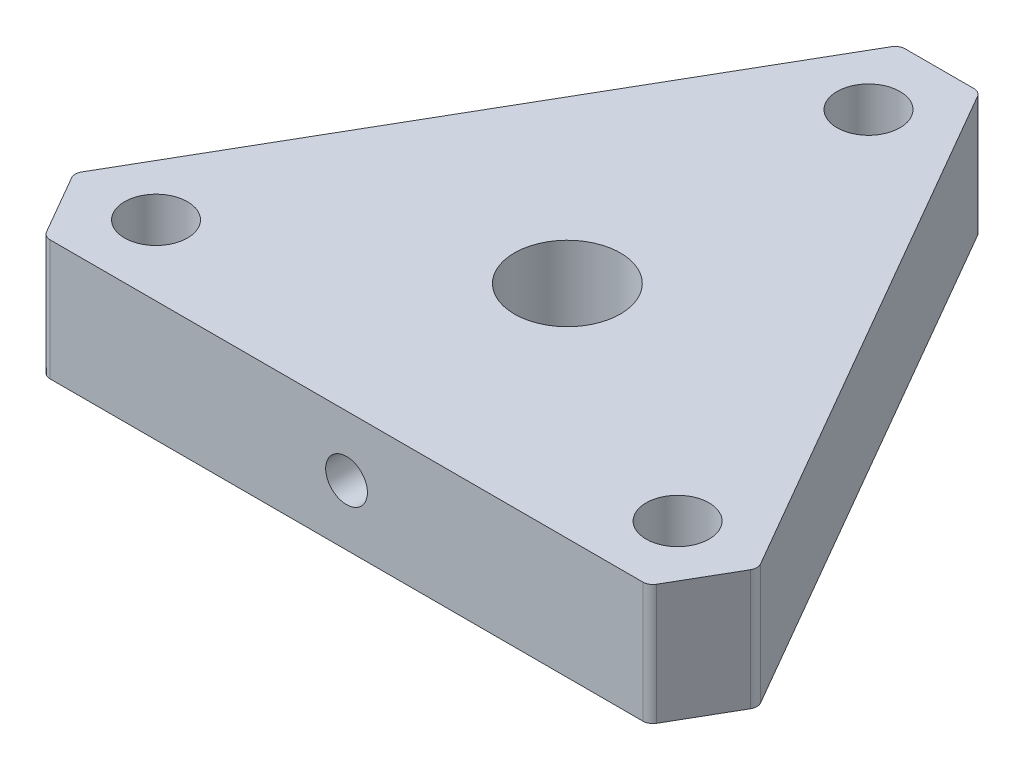
from build123d import *

# Parameters (mm, degrees)
SKETCH1_R                        = 4.191
BOSS_EXTRUDE1_DEPTH              = 9.525
F_10_CLEARANCE_HOLE1_D           = 4.9784
TAP_DRILL_FOR_M4X0_7_TAP1_REACH  = 62.679
TAP_DRILL_FOR_M4X0_7_TAP1_BORE_R = 1.65
CHAMFER1_SIZE                    = 6.35
CHAMFER1_EDGE_2_SIZE             = 6.35
CHAMFER1_EDGE_3_SIZE             = 6.35
FILLET2_R                        = 0.79375


with BuildPart() as part:
    # Sketch1 → Boss-Extrude1 (new body)
    with BuildSketch(Plane(origin=(0, 0, 0), x_dir=(1, 0, 0), z_dir=(0, 1, 0))):
        Polygon((0, 34.925), (30.245937227, -17.4625), (-30.245937227, -17.4625), align=None)
        with Locations(Location((0, 0, 0), (0, 0, 270))):
            Circle(SKETCH1_R, mode=Mode.SUBTRACT)
    extrude(amount=-BOSS_EXTRUDE1_DEPTH)

    # #10 Clearance Hole1 (through all)
    with Locations(Plane(origin=(0, 0, -23.8125), x_dir=(0, 0, 1), z_dir=(0, 1, 0))):
        with Locations((0, 0), (35.71875, 20.622229928), (35.71875, -20.622229928)):
            Hole(F_10_CLEARANCE_HOLE1_D / 2)

    # Tap Drill for M4x0.7 Tap1 bore (on position points) → Tap Drill for M4x0.7 Tap1 (cut, up to next)
    with BuildSketch(Plane(origin=(0, -4.7625, 17.4625), x_dir=(1, 0, 0), z_dir=(0, 0, 1)), mode=Mode.PRIVATE) as tap_drill_for_m4x0_7_tap1_sk1:
        Circle(TAP_DRILL_FOR_M4X0_7_TAP1_BORE_R)
    tap_drill_for_m4x0_7_tap1_tool1 = extrude(tap_drill_for_m4x0_7_tap1_sk1.sketch, amount=-TAP_DRILL_FOR_M4X0_7_TAP1_REACH, mode=Mode.PRIVATE) & part.part
    add(tap_drill_for_m4x0_7_tap1_tool1.solids().sort_by_distance((0, -4.7625, 17.4625))[0], mode=Mode.SUBTRACT)

    # Chamfer1
    chamfer1_edges = [part.edges().sort_by_distance(p)[0] for p in [
        (0, -4.7625, -34.925),
    ]]
    chamfer(chamfer1_edges, length=CHAMFER1_SIZE)

    # Chamfer1 edge 2
    chamfer1_edge_2_edges = [part.edges().sort_by_distance(p)[0] for p in [
        (30.245937227, -4.7625, 17.4625),
    ]]
    chamfer(chamfer1_edge_2_edges, length=CHAMFER1_EDGE_2_SIZE)

    # Chamfer1 edge 3
    chamfer1_edge_3_edges = [part.edges().sort_by_distance(p)[0] for p in [
        (-30.245937227, -4.7625, 17.4625),
    ]]
    chamfer(chamfer1_edge_3_edges, length=CHAMFER1_EDGE_3_SIZE)

    # Fillet2
    fillet2_edges = [part.edges().sort_by_distance(p)[0] for p in [
        (-3.175, -4.7625, -29.425738686),
        (-27.070937227, -4.7625, 11.963238686),
        (23.895937227, -4.7625, 17.4625),
        (-23.895937227, -4.7625, 17.4625),
        (3.175, -4.7625, -29.425738686),
        (27.070937227, -4.7625, 11.963238686),
    ]]
    fillet(fillet2_edges, radius=FILLET2_R)


solid = part.part
